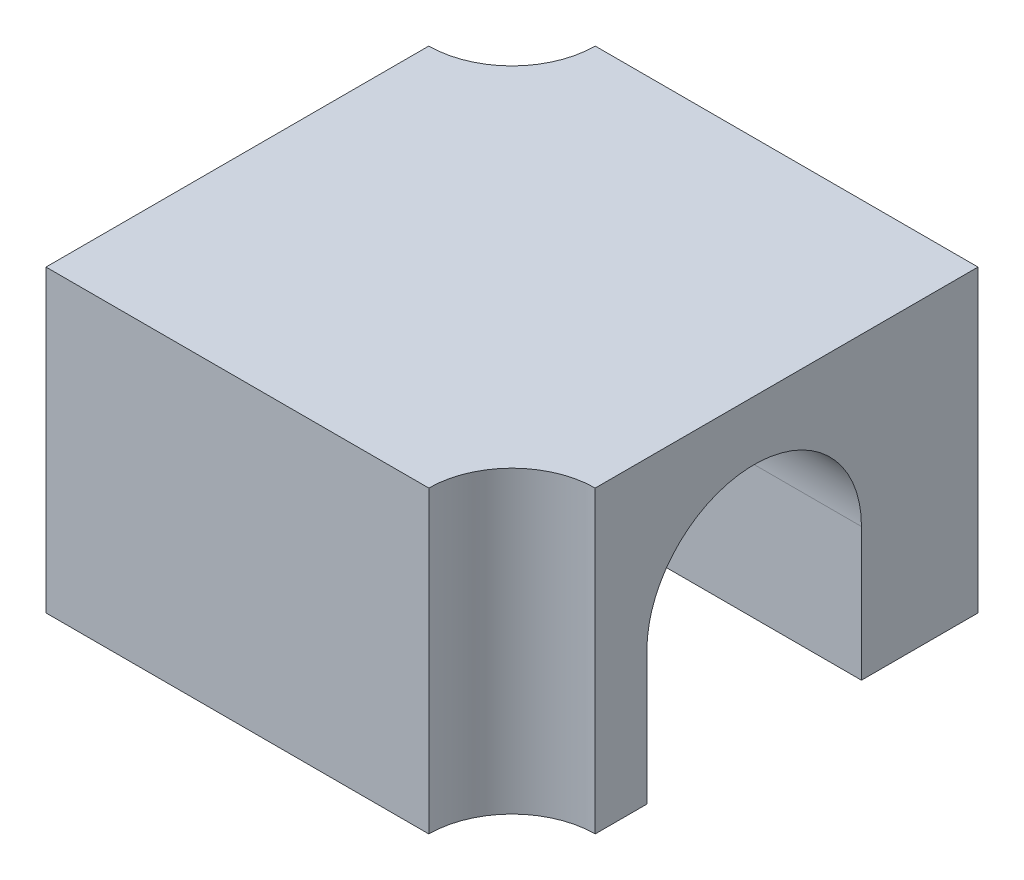
from build123d import *

# Parameters (mm, degrees)
SKETCH_1_W          = 56
SKETCH_1_H          = 56
EXTRUDE_1_DEPTH     = 36
SKETCH_3_R          = 12.893800992
CUT_EXTRUDE_5_DEPTH = 56
CUT_EXTRUDE_6_DEPTH = 56


with BuildPart() as part:
    # 草图1 → 凸台-拉伸1 (new body)
    with BuildSketch(Plane(origin=(0, 0, 0), x_dir=(1, 0, 0), z_dir=(0, 1, 0))):
        with Locations((36.119558337, -6.81415619)):
            Rectangle(SKETCH_1_W, SKETCH_1_H)
    extrude(amount=EXTRUDE_1_DEPTH)

    # 草图3 → 切除-拉伸5 (cut)
    with BuildSketch(Plane(origin=(64.119558337, 0, 0), x_dir=(0, 0, -1), z_dir=(1, 0, 0))):
        with Locations((-5.712666973, 16)):
            Circle(SKETCH_3_R)
        with BuildLine():
            ThreePointArc((7.181134019, 16), (-5.712666973, 3.106199008), (-18.606467966, 16))
            Line((-18.606467966, 16), (-18.606467966, 0))
            Line((-18.606467966, 0), (7.181134019, 0))
            Line((7.181134019, 0), (7.181134019, 16))
        make_face()
    extrude(amount=-CUT_EXTRUDE_5_DEPTH, mode=Mode.SUBTRACT)

    # 草图5 → 切除-拉伸6 (cut)
    with BuildSketch(Plane(origin=(0, 36, 0), x_dir=(1, 0, 0), z_dir=(0, 1, 0))):
        with BuildLine():
            ThreePointArc((54.119558337, -34.81415619), (64.119558337, -44.81415619), (74.119558337, -34.81415619))
            ThreePointArc((74.119558337, -34.81415619), (71.190626149, -27.743088379), (64.119558337, -24.81415619))
            Line((64.119558337, -24.81415619), (64.119558337, -34.81415619))
            Line((64.119558337, -34.81415619), (54.119558337, -34.81415619))
        make_face()
        with BuildLine():
            Line((64.119558337, -34.81415619), (64.119558337, -24.81415619))
            ThreePointArc((64.119558337, -24.81415619), (57.048490525, -27.743088379), (54.119558337, -34.81415619))
            Line((54.119558337, -34.81415619), (64.119558337, -34.81415619))
        make_face()
        with BuildLine():
            Line((8.119558337, 21.18584381), (18.119558337, 21.18584381))
            ThreePointArc((18.119558337, 21.18584381), (1.048490525, 28.256911621), (8.119558337, 11.18584381))
            Line((8.119558337, 11.18584381), (8.119558337, 21.18584381))
        make_face()
        with BuildLine():
            ThreePointArc((8.119558337, 11.18584381), (15.190626149, 14.114775998), (18.119558337, 21.18584381))
            Line((18.119558337, 21.18584381), (8.119558337, 21.18584381))
            Line((8.119558337, 21.18584381), (8.119558337, 11.18584381))
        make_face()
    extrude(amount=-CUT_EXTRUDE_6_DEPTH, mode=Mode.SUBTRACT)


solid = part.part
